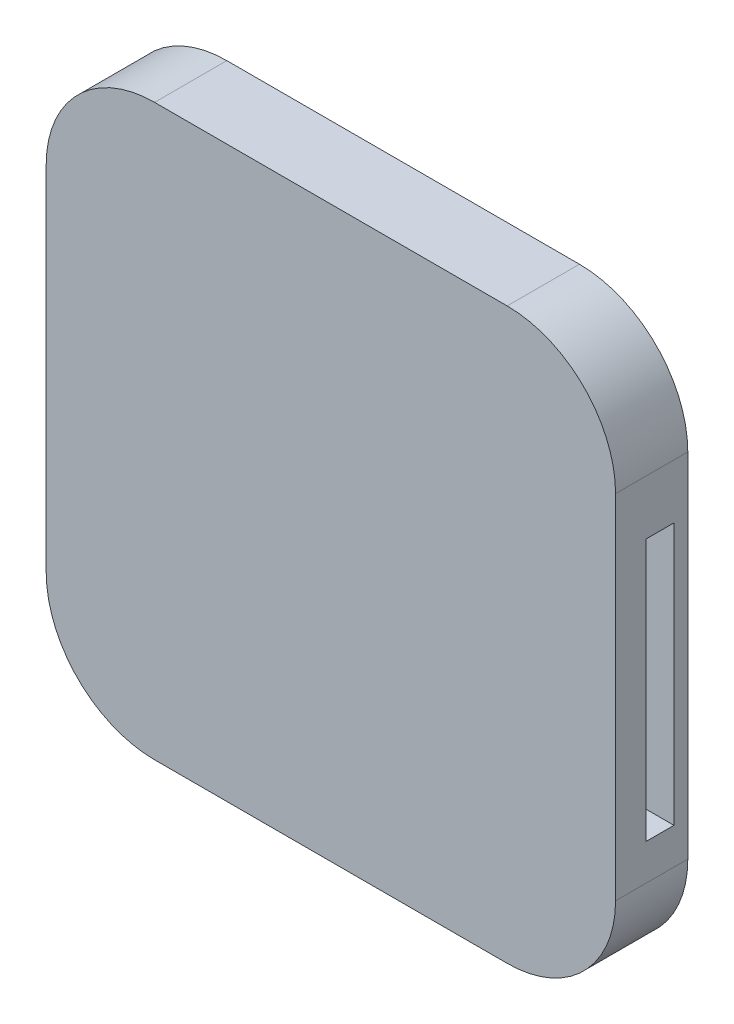
from build123d import *

# Parameters (mm, degrees)
SKETCH2_W           = 100.076
SKETCH2_H           = 100.076
BOSS_EXTRUDE2_DEPTH = 12.7
FILLET1_R           = 19.05
SKETCH3_W           = 4.948209201
SKETCH3_H           = 46.039859528
CUT_EXTRUDE1_DEPTH  = 9.906


with BuildPart() as part:
    # Sketch2 → Boss-Extrude2 (new body)
    with BuildSketch(Plane.XY):
        with Locations((20.865266409, -15.842146718)):
            Rectangle(SKETCH2_W, SKETCH2_H)
    extrude(amount=BOSS_EXTRUDE2_DEPTH)

    # Fillet1
    fillet1_edges = [part.edges().sort_by_distance(p)[0] for p in [
        (-29.172733591, 34.195853282, 6.35),
        (70.903266409, 34.195853282, 6.35),
        (70.903266409, -65.880146718, 6.35),
        (-29.172733591, -65.880146718, 6.35),
    ]]
    fillet(fillet1_edges, radius=FILLET1_R)

    # Sketch3 → Cut-Extrude1 (cut)
    with BuildSketch(Plane(origin=(70.903266409, 0, 0), x_dir=(0, 0, -1), z_dir=(1, 0, 0))):
        with Locations((-4.90705885, -17.455693197)):
            Rectangle(SKETCH3_W, SKETCH3_H)
    extrude(amount=-CUT_EXTRUDE1_DEPTH, mode=Mode.SUBTRACT)


solid = part.part
